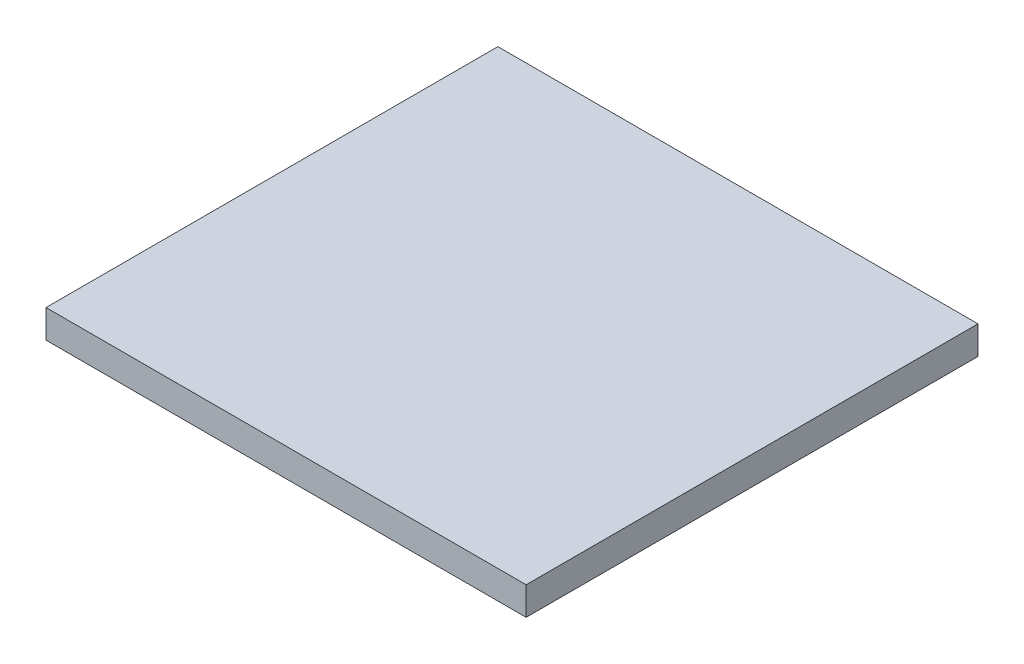
from build123d import *

# Parameters (mm, degrees)
SKETCH1_W           = 34
SKETCH1_H           = 32
BOSS_EXTRUDE1_DEPTH = 2


with BuildPart() as part:
    # Sketch1 → Boss-Extrude1 (new body)
    with BuildSketch(Plane(origin=(0, 0, 0), x_dir=(1, 0, 0), z_dir=(0, 1, 0))):
        Rectangle(SKETCH1_W, SKETCH1_H)
    extrude(amount=BOSS_EXTRUDE1_DEPTH)


solid = part.part
